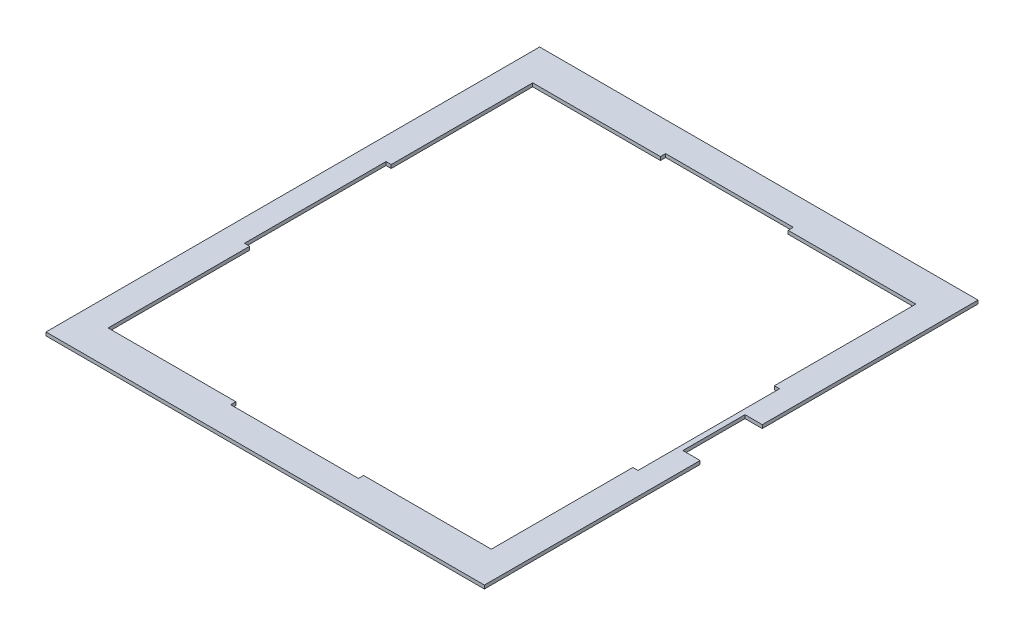
from build123d import *

# Parameters (mm, degrees)
BOSS_EXTRUDE1_DEPTH = 2


with BuildPart() as part:
    # Sketch1 → Boss-Extrude1 (new body)
    with BuildSketch(Plane(origin=(0, 0, 0), x_dir=(1, 0, 0), z_dir=(0, 1, 0))):
        Polygon((-127, -143), (127, -143), (127, -18), (117, -18), (117, 18), (127, 18), (127, 143), (-127, 143), align=None)
        Polygon((37, 123), (111, 123), (111, 41), (114, 41), (114, -41), (111, -41), (111, -123), (37, -123), (37, -126), (-37, -126), (-37, -123), (-111, -123), (-111, -41), (-114, -41), (-114, 41), (-111, 41), (-111, 123), (-37, 123), (-37, 126), (37, 126), align=None, mode=Mode.SUBTRACT)
    extrude(amount=BOSS_EXTRUDE1_DEPTH)


solid = part.part
